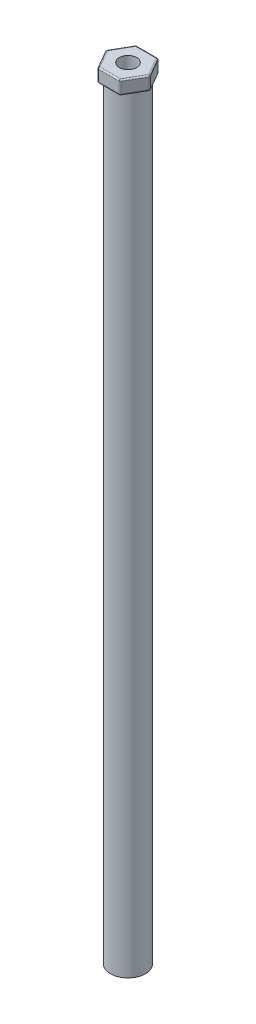
from build123d import *

# Parameters (mm, degrees)
SKETCH1_R           = 6.35
SKETCH1_R_2         = 3.175
BOSS_EXTRUDE1_DEPTH = 279.4
SKETCH2_R           = 3.175
BOSS_EXTRUDE2_DEPTH = 5
FILLET1_R           = 0.5


with BuildPart() as part:
    # Sketch1 → Boss-Extrude1 (new body)
    with BuildSketch(Plane(origin=(0, 0, 0), x_dir=(1, 0, 0), z_dir=(0, 1, 0))):
        with Locations(Location((0, 0, 0), (0, 0, 270))):
            Circle(SKETCH1_R)
        with Locations(Location((0, 0, 0), (0, 0, 270))):
            Circle(SKETCH1_R_2, mode=Mode.SUBTRACT)
    extrude(amount=BOSS_EXTRUDE1_DEPTH)

    # Sketch2 → Boss-Extrude2 (add)
    with BuildSketch(Plane(origin=(0, 279.4, 0), x_dir=(1, 0, 0), z_dir=(0, 1, 0))):
        Polygon((-8.065583261, 0), (-4.03279163, -6.985), (4.03279163, -6.985), (8.065583261, 0), (4.03279163, 6.985), (-4.03279163, 6.985), align=None)
        with Locations(Location((0, 0, 0), (0, 0, 270))):
            Circle(SKETCH2_R, mode=Mode.SUBTRACT)
    extrude(amount=BOSS_EXTRUDE2_DEPTH)

    # Fillet1
    fillet1_edges = [part.edges().sort_by_distance(p)[0] for p in [
        (-6.049187445, 284.4, -3.4925),
        (-6.049187445, 284.4, 3.4925),
        (0, 284.4, 6.985),
        (6.049187445, 284.4, 3.4925),
        (6.049187445, 284.4, -3.4925),
        (0, 284.4, -6.985),
        (-6.049187445, 279.4, -3.4925),
        (-4.03279163, 281.9, -6.985),
        (-6.049187445, 279.4, 3.4925),
        (-8.065583261, 281.9, 0),
        (0, 279.4, 6.985),
        (-4.03279163, 281.9, 6.985),
        (6.049187445, 279.4, 3.4925),
        (4.03279163, 281.9, 6.985),
        (6.049187445, 279.4, -3.4925),
        (8.065583261, 281.9, 0),
        (0, 279.4, -6.985),
        (4.03279163, 281.9, -6.985),
    ]]
    fillet(fillet1_edges, radius=FILLET1_R)


solid = part.part
